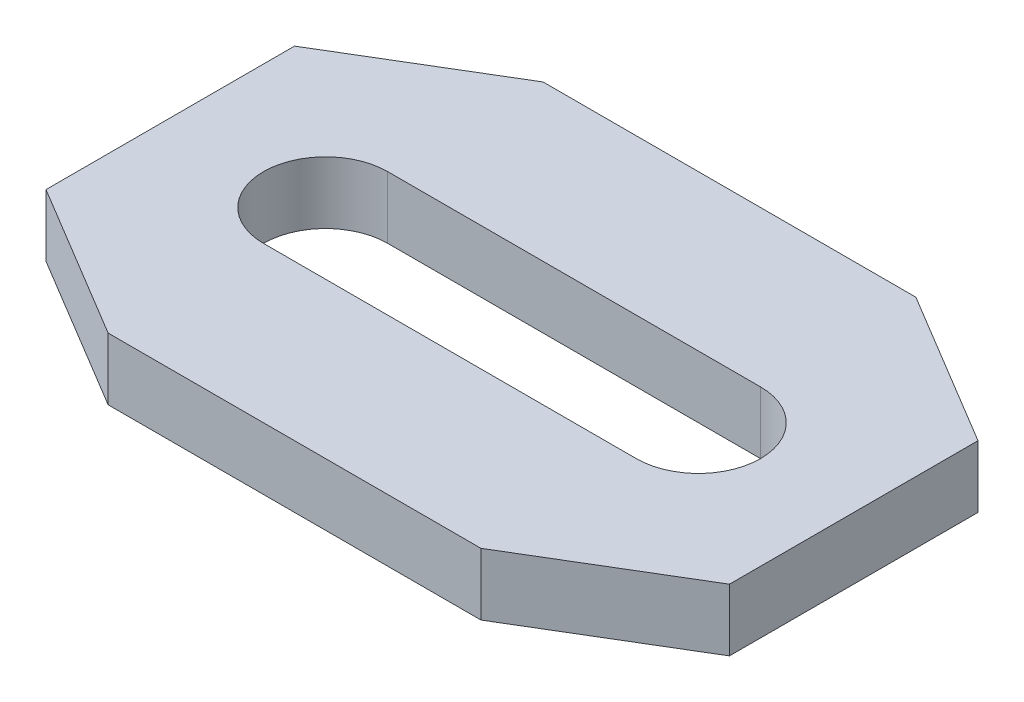
from build123d import *

# Parameters (mm, degrees)
BOSS_EXTRUDE1_DEPTH = 12.7


with BuildPart() as part:
    # Sketch2 → Boss-Extrude1 (new body)
    with BuildSketch(Plane(origin=(0, 0, 0), x_dir=(1, 0, 0), z_dir=(0, 1, 0))):
        Polygon((0, 44.45), (-31.75, 25.4), (-31.75, -25.4), (0, -44.45), (76.2, -44.45), (107.95, -25.4), (107.95, 25.4), (76.2, 44.45), align=None)
        with BuildLine():
            Line((0, 12.7), (76.2, 12.7))
            ThreePointArc((76.2, 12.7), (88.9, 0), (76.2, -12.7))
            Line((76.2, -12.7), (0, -12.7))
            ThreePointArc((0, -12.7), (-12.7, 0), (0, 12.7))
        make_face(mode=Mode.SUBTRACT)
    extrude(amount=BOSS_EXTRUDE1_DEPTH)


solid = part.part
